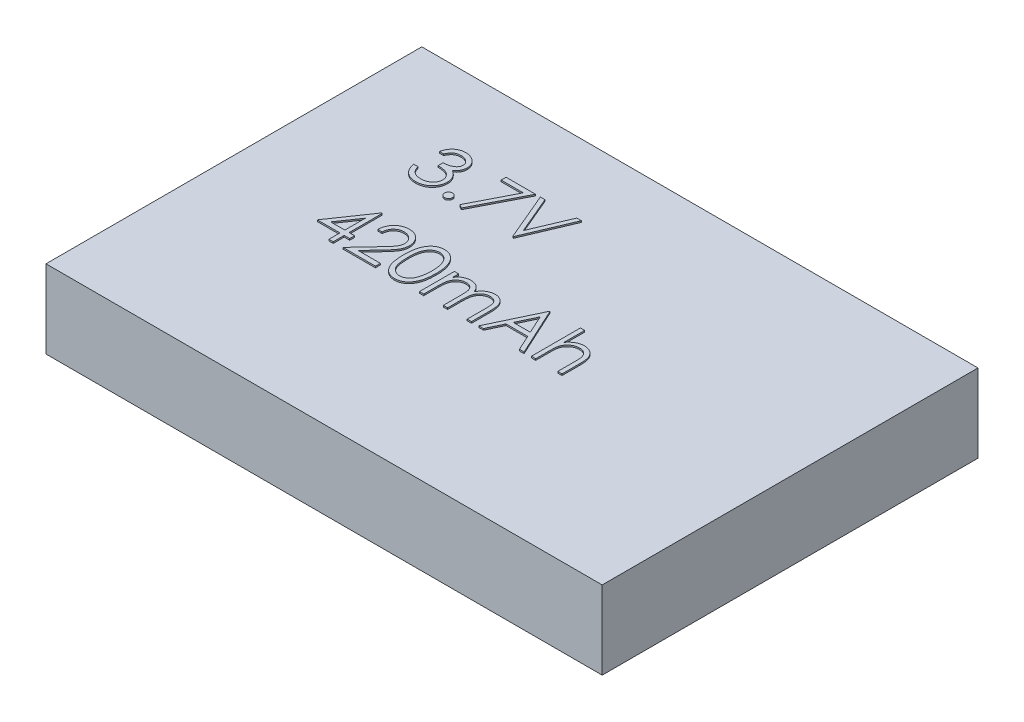
from build123d import *

# Parameters (mm, degrees)
SKETCH1_W           = 37
SKETCH1_H           = 25
BOSS_EXTRUDE1_DEPTH = 5.2
BOSS_EXTRUDE2_DEPTH = 0.1


with BuildPart() as part:
    # Sketch1 → Boss-Extrude1 (new body)
    with BuildSketch(Plane(origin=(0, 0, 0), x_dir=(1, 0, 0), z_dir=(0, 1, 0))):
        Rectangle(SKETCH1_W, SKETCH1_H)
    extrude(amount=BOSS_EXTRUDE1_DEPTH)

    # Sketch2 → Boss-Extrude2 (add)
    # profile 1 of 10: a face of its own
    with BuildSketch(Plane(origin=(0, 5.2, 0), x_dir=(1, 0, 0), z_dir=(0, 1, 0))):
        with BuildLine():
            Line((-11.502245155, 6.957480205), (-11.787181052, 6.957480205))
            add(Edge.make_bspline(
                [(-11.787181052, 6.957480205), (-11.779461674, 6.989441101), (-11.764370921, 7.051922039), (-11.732895265, 7.141191483), (-11.698605941, 7.22566782), (-11.657431539, 7.303769258), (-11.612520026, 7.377065406), (-11.561064415, 7.443893826), (-11.505438666, 7.505954159), (-11.443911748, 7.561029739), (-11.379387891, 7.610902393), (-11.310957914, 7.653424766), (-11.239998575, 7.690004534), (-11.166018233, 7.72014003), (-11.088796634, 7.742841755), (-11.009031905, 7.759312571), (-10.926515015, 7.770008796), (-10.870501129, 7.771052703), (-10.842058857, 7.771582769)],
                knots=[0, 0, 0, 0, 1.162005537, 2.271625781, 3.343758855, 4.383309926, 5.390229558, 6.379919256, 7.361854164, 8.333198761, 9.295911338, 10.242430842, 11.177959212, 12.116337295, 13.062827104, 14.020064771, 14.994644689, 16, 16, 16, 16], degree=3))
            add(Edge.make_bspline(
                [(-10.842058857, 7.771582769), (-10.800618084, 7.77033161), (-10.718640481, 7.767856584), (-10.598205431, 7.745255631), (-10.482066817, 7.709491404), (-10.371495856, 7.660075951), (-10.268790564, 7.59912746), (-10.177408451, 7.52658802), (-10.098588159, 7.443857225), (-10.032462545, 7.352478399), (-9.980687368, 7.254819473), (-9.942509015, 7.154307901), (-9.91926649, 7.051182113), (-9.91625427, 6.981552296), (-9.914745155, 6.946667905)],
                knots=[0, 0, 0, 0, 1.083050992, 2.142477498, 3.193116406, 4.255571735, 5.30263384, 6.308962982, 7.297363603, 8.282367274, 9.249857812, 10.179914175, 11.08814088, 12, 12, 12, 12], degree=3))
            add(Edge.make_bspline(
                [(-9.914745155, 6.946667905), (-9.915800698, 6.913097456), (-9.917866233, 6.847405296), (-9.935404666, 6.751500795), (-9.964919704, 6.661111629), (-10.005804417, 6.575857289), (-10.058728538, 6.496278327), (-10.12283877, 6.422195697), (-10.198587613, 6.353280818), (-10.25599065, 6.313802439), (-10.285543432, 6.293477801)],
                knots=[0, 0, 0, 0, 1.024540389, 2.004866551, 2.965041327, 3.920577974, 4.882998113, 5.874504559, 6.905732034, 8, 8, 8, 8], degree=3))
            add(Edge.make_bspline(
                [(-10.285543432, 6.293477801), (-10.251768912, 6.277169031), (-10.184851819, 6.244856641), (-10.093638124, 6.18148749), (-10.010836051, 6.10832066), (-9.964659106, 6.051222682), (-9.941457895, 6.022534292)],
                knots=[0, 0, 0, 0, 1.015518401, 2.012035669, 3.001164323, 4, 4, 4, 4], degree=3))
            add(Edge.make_bspline(
                [(-9.941457895, 6.022534292), (-9.926180392, 6.001617617), (-9.895875565, 5.960126793), (-9.858469045, 5.893418749), (-9.824533634, 5.825971327), (-9.798090221, 5.755976723), (-9.777612499, 5.684246203), (-9.762974812, 5.610656601), (-9.753881484, 5.535147823), (-9.752579234, 5.484064359), (-9.751924642, 5.458386655)],
                knots=[0, 0, 0, 0, 1.025084078, 2.033381695, 3.024893161, 4.013698104, 4.991890475, 5.976764909, 6.982997093, 8, 8, 8, 8], degree=3))
            add(Edge.make_bspline(
                [(-9.751924642, 5.458386655), (-9.753552522, 5.413927837), (-9.756800622, 5.325219424), (-9.785832889, 5.194160212), (-9.830839186, 5.066048506), (-9.894753692, 4.943516331), (-9.972647789, 4.828871271), (-10.065319076, 4.726294905), (-10.171714604, 4.638121885), (-10.290374014, 4.564452607), (-10.418931695, 4.505562777), (-10.55643241, 4.46468924), (-10.700894959, 4.438068226), (-10.799961579, 4.435213566), (-10.850327086, 4.433762256)],
                knots=[0, 0, 0, 0, 0.955779014, 1.907060117, 2.875433937, 3.871313158, 4.872415639, 5.851225146, 6.836215519, 7.83643374, 8.849228613, 9.86973379, 10.916971861, 12, 12, 12, 12], degree=3))
            add(Edge.make_bspline(
                [(-10.850327086, 4.433762256), (-10.884271737, 4.43454985), (-10.951063491, 4.436099571), (-11.049255807, 4.446693731), (-11.142983349, 4.466043093), (-11.232372841, 4.492081091), (-11.317503696, 4.5250936), (-11.398116134, 4.566204133), (-11.474706109, 4.614565281), (-11.546550871, 4.670747893), (-11.613641858, 4.733595966), (-11.674196115, 4.80422521), (-11.729223213, 4.881329998), (-11.777249749, 4.965805914), (-11.820463271, 5.056561254), (-11.856005996, 5.154758106), (-11.887289333, 5.259518612), (-11.901833975, 5.332523419), (-11.909296437, 5.369980205)],
                knots=[0, 0, 0, 0, 1.048658725, 2.063410685, 3.046034179, 4.001477787, 4.936774919, 5.862367409, 6.792675028, 7.730719943, 8.675894397, 9.627829632, 10.600096036, 11.597688215, 12.626045268, 13.701542398, 14.82072376, 16, 16, 16, 16], degree=3))
            Line((-11.909296437, 5.369980205), (-11.624360539, 5.369980205))
            add(Edge.make_bspline(
                [(-11.624360539, 5.369980205), (-11.616937125, 5.3455336), (-11.602497939, 5.29798283), (-11.57791954, 5.229547696), (-11.549917608, 5.166811462), (-11.519877973, 5.109313915), (-11.488328954, 5.056488807), (-11.453027557, 5.009732969), (-11.416588404, 4.96699275), (-11.389120705, 4.942912995), (-11.375677647, 4.931128042)],
                knots=[0, 0, 0, 0, 1.198163088, 2.33053128, 3.407730985, 4.417276592, 5.372219308, 6.28897303, 7.162600585, 8, 8, 8, 8], degree=3))
            add(Edge.make_bspline(
                [(-11.375677647, 4.931128042), (-11.357900752, 4.917422624), (-11.322401837, 4.890054096), (-11.264554941, 4.855127618), (-11.203717509, 4.824864402), (-11.13857134, 4.80174705), (-11.070522227, 4.782173029), (-10.99847026, 4.769363701), (-10.923051113, 4.760575145), (-10.871554642, 4.7597996), (-10.845238945, 4.759403282)],
                knots=[0, 0, 0, 0, 0.946170439, 1.889420265, 2.845303464, 3.807233317, 4.801018734, 5.828864929, 6.890507805, 8, 8, 8, 8], degree=3))
            add(Edge.make_bspline(
                [(-10.845238945, 4.759403282), (-10.815526839, 4.759961996), (-10.757427381, 4.761054513), (-10.672650473, 4.771101761), (-10.591998717, 4.785734351), (-10.516367562, 4.808333985), (-10.444766317, 4.836256615), (-10.378198677, 4.87131624), (-10.315790781, 4.91245038), (-10.258341963, 4.95920376), (-10.206684253, 5.010386116), (-10.161200551, 5.063919402), (-10.122533894, 5.119577904), (-10.091343077, 5.177669628), (-10.066713649, 5.237954014), (-10.049946746, 5.300600238), (-10.038288586, 5.365095615), (-10.037339159, 5.408936894), (-10.036860539, 5.431037897)],
                knots=[0, 0, 0, 0, 1.217147791, 2.380027433, 3.494444702, 4.572153297, 5.609568379, 6.639424714, 7.649109417, 8.668170816, 9.669597737, 10.625200337, 11.543417969, 12.441394052, 13.322311151, 14.205496177, 15.095365482, 16, 16, 16, 16], degree=3))
            add(Edge.make_bspline(
                [(-10.036860539, 5.431037897), (-10.038248742, 5.46062104), (-10.041018238, 5.519640125), (-10.06216245, 5.606469639), (-10.096941276, 5.690129449), (-10.145629912, 5.769192201), (-10.204898751, 5.842467483), (-10.274172631, 5.907846614), (-10.35402681, 5.961794482), (-10.427523405, 5.999067763), (-10.492624654, 6.024501396), (-10.548337182, 6.041442256), (-10.610709243, 6.055787501), (-10.678986574, 6.069133633), (-10.753683635, 6.080492285), (-10.834719103, 6.089964503), (-10.922109401, 6.097543719), (-10.982607816, 6.100928355), (-11.013783616, 6.102672513)],
                knots=[0, 0, 0, 0, 1.07054697, 2.135767047, 3.216561865, 4.33974944, 5.486079747, 6.621378074, 7.775625952, 8.963672916, 9.598146892, 10.304877434, 11.070270905, 11.915000392, 12.823868403, 13.805723172, 14.86925407, 16, 16, 16, 16], degree=3))
            Line((-11.013783616, 6.102672513), (-11.013783616, 6.428313538))
            add(Edge.make_bspline(
                [(-11.013783616, 6.428313538), (-10.974503273, 6.42898011), (-10.89756273, 6.430285761), (-10.785172897, 6.446077313), (-10.677700678, 6.467921883), (-10.577527848, 6.501382022), (-10.486225086, 6.540244291), (-10.407013733, 6.585467367), (-10.341003535, 6.635736461), (-10.288515277, 6.691827471), (-10.249028048, 6.751984692), (-10.220156596, 6.814683375), (-10.203102015, 6.880473058), (-10.200825388, 6.925371793), (-10.199681052, 6.947939941)],
                knots=[0, 0, 0, 0, 1.321986639, 2.589447074, 3.816329219, 5.01088745, 6.139805852, 7.153945165, 8.075214402, 8.924034688, 9.728124013, 10.488707548, 11.240355623, 12, 12, 12, 12], degree=3))
            add(Edge.make_bspline(
                [(-10.199681052, 6.947939941), (-10.200056982, 6.964520467), (-10.200804877, 6.997506637), (-10.210236693, 7.045698663), (-10.22440993, 7.092417378), (-10.243895113, 7.137464106), (-10.269975651, 7.180526426), (-10.301186796, 7.221971469), (-10.338350715, 7.261562611), (-10.380936942, 7.298465473), (-10.426667651, 7.333634709), (-10.47678709, 7.36349208), (-10.529784076, 7.389023672), (-10.585717285, 7.410078006), (-10.64476823, 7.425916075), (-10.706659464, 7.437287874), (-10.771509006, 7.444397746), (-10.815751934, 7.445421381), (-10.838242751, 7.445941743)],
                knots=[0, 0, 0, 0, 0.884392785, 1.759457502, 2.611959086, 3.489218968, 4.37281399, 5.2945488, 6.255912374, 7.266815255, 8.301784654, 9.332968512, 10.37626691, 11.440494194, 12.520033166, 13.637162961, 14.798855837, 16, 16, 16, 16], degree=3))
            add(Edge.make_bspline(
                [(-10.838242751, 7.445941743), (-10.874393907, 7.444679579), (-10.945005523, 7.442214279), (-11.046800483, 7.420621546), (-11.141433022, 7.386169999), (-11.213767384, 7.345046474), (-11.26718229, 7.304451437), (-11.305352084, 7.26899813), (-11.34283569, 7.229598354), (-11.377167125, 7.183825399), (-11.41188709, 7.134779097), (-11.443496085, 7.079966186), (-11.474211663, 7.020816485), (-11.49271969, 6.979001159), (-11.502245155, 6.957480205)],
                knots=[0, 0, 0, 0, 1.472543308, 2.876219568, 4.221790263, 5.565193594, 6.249813518, 6.953379497, 7.687249741, 8.463570142, 9.283606569, 10.136032583, 11.040678096, 12, 12, 12, 12], degree=3))
        make_face()
    # profile 2 of 10: a face of its own
    with BuildSketch(Plane(origin=(0, 5.2, 0), x_dir=(1, 0, 0), z_dir=(0, 1, 0))):
        with BuildLine():
            add(Edge.make_bspline(
                [(-8.958174642, 5.003634051), (-8.940494235, 5.002583429), (-8.905833865, 5.000523806), (-8.855724084, 4.986393537), (-8.810371786, 4.961303181), (-8.769974678, 4.927863375), (-8.73667666, 4.887318023), (-8.71069214, 4.842327449), (-8.696684961, 4.791798147), (-8.694640341, 4.756936942), (-8.693591309, 4.739050718)],
                knots=[0, 0, 0, 0, 1.020151414, 1.999887582, 2.974338812, 3.990962822, 5.007586832, 5.987933904, 6.967670073, 8, 8, 8, 8], degree=3))
            add(Edge.make_bspline(
                [(-8.693591309, 4.739050718), (-8.694675889, 4.721594269), (-8.696814667, 4.687170407), (-8.710660032, 4.637022223), (-8.736874692, 4.592003531), (-8.769745007, 4.55090802), (-8.810381772, 4.517397374), (-8.855831304, 4.492520482), (-8.905716231, 4.477378472), (-8.94047461, 4.475449617), (-8.958174642, 4.474467384)],
                knots=[0, 0, 0, 0, 1.009421747, 1.99056486, 2.972319754, 3.999869655, 5.017953583, 5.993804169, 6.978383603, 8, 8, 8, 8], degree=3))
            add(Edge.make_bspline(
                [(-8.958174642, 4.474467384), (-8.975887428, 4.475414076), (-9.010467426, 4.477262266), (-9.060166149, 4.492831384), (-9.105892471, 4.517164094), (-9.146521323, 4.550970505), (-9.179666937, 4.591792063), (-9.204727106, 4.637332264), (-9.219776741, 4.687026854), (-9.221756011, 4.721565994), (-9.222757975, 4.739050718)],
                knots=[0, 0, 0, 0, 1.022052826, 1.995314843, 2.982371812, 4.00089066, 5.028879526, 6.005146991, 6.990147033, 8, 8, 8, 8], degree=3))
            add(Edge.make_bspline(
                [(-9.222757975, 4.739050718), (-9.2217945, 4.756966227), (-9.219913431, 4.791944059), (-9.204695511, 4.842017535), (-9.179861376, 4.887527476), (-9.146292196, 4.927801516), (-9.105902299, 4.961535712), (-9.060276456, 4.986087346), (-9.01034773, 5.000638292), (-8.975867286, 5.002618146), (-8.958174642, 5.003634051)],
                knots=[0, 0, 0, 0, 1.032775665, 2.016367738, 2.991239715, 4.008302682, 5.025365648, 6.011011707, 6.979408107, 8, 8, 8, 8], degree=3))
        make_face()
    # profile 3 of 10: a face of its own
    with BuildSketch(Plane(origin=(0, 5.2, 0), x_dir=(1, 0, 0), z_dir=(0, 1, 0))):
        Polygon((-8.083014386, 7.690172513), (-6.129168232, 7.690172513), (-7.798078488, 4.433762256), (-8.04421731, 4.569234011), (-6.611269594, 7.364531487), (-8.083014386, 7.364531487), align=None)
    # profile 4 of 10: a face of its own
    with BuildSketch(Plane(origin=(0, 5.2, 0), x_dir=(1, 0, 0), z_dir=(0, 1, 0))):
        Polygon((-5.803527206, 7.690172513), (-5.498238745, 7.690172513), (-4.439905411, 5.188079163), (-3.381572078, 7.690172513), (-3.076283616, 7.690172513), (-4.419552847, 4.515172513), (-4.460257975, 4.515172513), align=None)
    # profile 5 of 10: a face of its own
    with BuildSketch(Plane(origin=(0, 5.2, 0), x_dir=(1, 0, 0), z_dir=(0, 1, 0))):
        Polygon((-10.1761484, 1.479916102), (-10.118270796, 1.479916102), (-10.118270796, -0.718160821), (-9.751924642, -0.718160821), (-9.751924642, -1.043801846), (-10.118270796, -1.043801846), (-10.118270796, -1.776494154), (-10.403206693, -1.776494154), (-10.403206693, -1.043801846), (-11.909296437, -1.043801846), align=None)
        Polygon((-10.403206693, -0.718160821), (-10.403206693, 0.660725397), (-11.349600924, -0.718160821), align=None, mode=Mode.SUBTRACT)
    # profile 6 of 10: a face of its own
    with BuildSketch(Plane(origin=(0, 5.2, 0), x_dir=(1, 0, 0), z_dir=(0, 1, 0))):
        with BuildLine():
            Line((-9.059937463, 0.421582769), (-9.34487336, 0.421582769))
            add(Edge.make_bspline(
                [(-9.34487336, 0.421582769), (-9.3430163, 0.459384217), (-9.339369083, 0.533625256), (-9.322289135, 0.641869085), (-9.29784991, 0.745333081), (-9.26329552, 0.843186503), (-9.220381968, 0.936294564), (-9.168919729, 1.024287435), (-9.107965307, 1.106829442), (-9.038834913, 1.183155393), (-8.963751933, 1.253175546), (-8.882738688, 1.313641374), (-8.797607842, 1.364729547), (-8.708617673, 1.407438959), (-8.614764162, 1.439497248), (-8.516898998, 1.463284021), (-8.41459221, 1.47759542), (-8.344887333, 1.47913374), (-8.309436661, 1.479916102)],
                knots=[0, 0, 0, 0, 1.10065271, 2.161652631, 3.183658789, 4.190468796, 5.17591951, 6.163126047, 7.15150782, 8.156236427, 9.156009102, 10.134482811, 11.092018607, 12.041330605, 13.001268258, 13.972401359, 14.968799086, 16, 16, 16, 16], degree=3))
            add(Edge.make_bspline(
                [(-8.309436661, 1.479916102), (-8.274622265, 1.479101074), (-8.206213221, 1.477499573), (-8.106371251, 1.463746353), (-8.011323277, 1.442205709), (-7.921255089, 1.411983867), (-7.836885302, 1.371357994), (-7.757580111, 1.322555941), (-7.682395376, 1.266113665), (-7.614716365, 1.199661992), (-7.55256975, 1.128721257), (-7.498955561, 1.052985802), (-7.453042192, 0.974763521), (-7.414771939, 0.893457938), (-7.386599585, 0.808303505), (-7.365210782, 0.720539971), (-7.353120914, 0.629258893), (-7.351265422, 0.567476517), (-7.350322078, 0.536065942)],
                knots=[0, 0, 0, 0, 1.111607364, 2.184268762, 3.212621178, 4.221274766, 5.211760367, 6.196651075, 7.1921475, 8.207485113, 9.220403448, 10.201281604, 11.166441695, 12.114753415, 13.065576456, 14.026450734, 14.996634279, 16, 16, 16, 16], degree=3))
            add(Edge.make_bspline(
                [(-7.350322078, 0.536065942), (-7.351858109, 0.491844692), (-7.354903217, 0.404178213), (-7.380951258, 0.275350444), (-7.42163345, 0.150533557), (-7.470616767, 0.050079004), (-7.520031056, -0.030868522), (-7.564560437, -0.097515133), (-7.61668923, -0.169275094), (-7.677176153, -0.245908107), (-7.744769973, -0.328014428), (-7.820082936, -0.415544456), (-7.903652094, -0.507593848), (-7.962306591, -0.570463929), (-7.992699882, -0.60304163)],
                knots=[0, 0, 0, 0, 1.184426356, 2.348067706, 3.509069118, 4.696110526, 5.333549288, 6.050745305, 6.844228056, 7.710549037, 8.667450064, 9.695053472, 10.805634456, 12, 12, 12, 12], degree=3))
            Line((-7.992699882, -0.60304163), (-8.7870859, -1.450853128))
            Line((-8.7870859, -1.450853128), (-7.30961695, -1.450853128))
            Line((-7.30961695, -1.450853128), (-7.30961695, -1.776494154))
            Line((-7.30961695, -1.776494154), (-9.466988745, -1.776494154))
            Line((-9.466988745, -1.776494154), (-8.235658616, -0.462481734))
            add(Edge.make_bspline(
                [(-8.235658616, -0.462481734), (-8.205679462, -0.431186842), (-8.148095642, -0.371075758), (-8.066650018, -0.283316073), (-7.993498936, -0.201900418), (-7.928168873, -0.126982621), (-7.87207705, -0.057466841), (-7.822300097, 0.004395497), (-7.782417025, 0.061322748), (-7.739132344, 0.127308877), (-7.697209661, 0.207874336), (-7.661184881, 0.306329897), (-7.639218554, 0.407682476), (-7.636583454, 0.47617361), (-7.635257975, 0.510625237)],
                knots=[0, 0, 0, 0, 1.329631726, 2.553950428, 3.673215718, 4.687767853, 5.603093632, 6.413772471, 7.123043292, 7.734684054, 8.834405432, 9.900288307, 10.943827018, 12, 12, 12, 12], degree=3))
            add(Edge.make_bspline(
                [(-7.635257975, 0.510625237), (-7.635834684, 0.532289077), (-7.636971267, 0.574984346), (-7.647002179, 0.637582427), (-7.662160995, 0.697966222), (-7.683882765, 0.75632147), (-7.712554593, 0.812061454), (-7.747455445, 0.865254025), (-7.787723574, 0.916679015), (-7.834306511, 0.96489665), (-7.885479818, 1.009057458), (-7.939540316, 1.048177164), (-7.996735768, 1.080869786), (-8.056825022, 1.107669958), (-8.119640555, 1.12869334), (-8.185303859, 1.143260765), (-8.253633502, 1.152407019), (-8.300291031, 1.153644517), (-8.324065067, 1.154275077)],
                knots=[0, 0, 0, 0, 0.991446411, 1.95395049, 2.89581595, 3.838931463, 4.798493298, 5.75982156, 6.748411868, 7.785213223, 8.824556874, 9.840280684, 10.836137867, 11.835679398, 12.848801643, 13.863922112, 14.911575587, 16, 16, 16, 16], degree=3))
            add(Edge.make_bspline(
                [(-8.324065067, 1.154275077), (-8.348894322, 1.15362644), (-8.39765488, 1.152352626), (-8.469245717, 1.143442066), (-8.537540672, 1.128069768), (-8.602711542, 1.107045213), (-8.664868594, 1.080322101), (-8.723709549, 1.047037447), (-8.779102312, 1.007319564), (-8.831151016, 0.962288488), (-8.879106197, 0.912152878), (-8.921240148, 0.85626384), (-8.958055647, 0.795641828), (-8.99017688, 0.730450414), (-9.016262399, 0.660098057), (-9.036195186, 0.584834496), (-9.051967539, 0.504986528), (-9.057236697, 0.449845773), (-9.059937463, 0.421582769)],
                knots=[0, 0, 0, 0, 1.031018746, 2.02475058, 2.990194455, 3.934040569, 4.864654155, 5.795059489, 6.735614925, 7.690564532, 8.649604399, 9.611025574, 10.590972636, 11.591080095, 12.624614302, 13.701020113, 14.821632451, 16, 16, 16, 16], degree=3))
        make_face()
    # profile 7 of 10: a face of its own
    with BuildSketch(Plane(origin=(0, 5.2, 0), x_dir=(1, 0, 0), z_dir=(0, 1, 0))):
        with BuildLine():
            add(Edge.make_bspline(
                [(-7.024681052, -0.190266189), (-7.024383493, -0.139377845), (-7.02380548, -0.040526502), (-7.017375269, 0.103513852), (-7.006693352, 0.238642114), (-6.992054449, 0.364864753), (-6.974239996, 0.482214353), (-6.950458804, 0.590377312), (-6.923414333, 0.689854241), (-6.892070329, 0.780969527), (-6.856702834, 0.864950729), (-6.818208898, 0.943350733), (-6.775060834, 1.016050915), (-6.729724635, 1.084211625), (-6.680365113, 1.146717119), (-6.628386924, 1.204450106), (-6.571761365, 1.256076287), (-6.51241335, 1.30310829), (-6.449805558, 1.344337453), (-6.385722568, 1.380652866), (-6.319723293, 1.411677031), (-6.251627541, 1.436070498), (-6.182047364, 1.456218909), (-6.110739525, 1.469997455), (-6.037586288, 1.478666936), (-5.9882092, 1.479495763), (-5.963167631, 1.479916102)],
                knots=[0, 0, 0, 0, 1.646270934, 3.197905019, 4.663502075, 6.030701355, 7.308322542, 8.50163776, 9.611534131, 10.641858119, 11.616356847, 12.558055219, 13.465016945, 14.349605745, 15.204443733, 16.039544428, 16.859896111, 17.680448484, 18.487036065, 19.28249412, 20.06191084, 20.843045899, 21.620316918, 22.403196591, 23.190181807, 24, 24, 24, 24], degree=3))
            add(Edge.make_bspline(
                [(-5.963167631, 1.479916102), (-5.937916875, 1.479473584), (-5.887701067, 1.478593555), (-5.813460155, 1.470135407), (-5.740934373, 1.456100889), (-5.670432918, 1.436215433), (-5.601376681, 1.411545069), (-5.534305797, 1.380623184), (-5.468803658, 1.344628783), (-5.405911183, 1.302334266), (-5.344937925, 1.255178915), (-5.287381558, 1.20187278), (-5.233236845, 1.142954106), (-5.181824246, 1.079053273), (-5.134602383, 1.00894466), (-5.089632198, 0.933847646), (-5.049380423, 0.852448933), (-5.010613967, 0.766106651), (-4.977152201, 0.672431761), (-4.946974964, 0.5719523), (-4.9225919, 0.46348143), (-4.902281631, 0.347588265), (-4.886547333, 0.223847191), (-4.875087722, 0.092523462), (-4.86903428, -0.046469321), (-4.867894273, -0.141499656), (-4.867309257, -0.190266189)],
                knots=[0, 0, 0, 0, 0.810914788, 1.612654377, 2.396697861, 3.181598691, 3.963628158, 4.749916497, 5.551656086, 6.361998678, 7.18212741, 8.025565596, 8.878627764, 9.750805457, 10.657531673, 11.591944965, 12.560506719, 13.57287815, 14.630710178, 15.753379473, 16.941251878, 18.199788006, 19.531962791, 20.947069417, 22.433333509, 24, 24, 24, 24], degree=3))
            add(Edge.make_bspline(
                [(-4.867309257, -0.190266189), (-4.867900338, -0.23882002), (-4.869052033, -0.333425179), (-4.87501986, -0.471792564), (-4.88677519, -0.60241936), (-4.901479965, -0.725618851), (-4.921846196, -0.840878263), (-4.946888025, -0.948596441), (-4.974692247, -1.049238563), (-5.00901381, -1.141980142), (-5.04657924, -1.228114919), (-5.087450739, -1.30854869), (-5.131238367, -1.383992398), (-5.178943872, -1.453842168), (-5.229792325, -1.518592807), (-5.284872034, -1.577101365), (-5.34263035, -1.630777617), (-5.403783041, -1.678540165), (-5.467656377, -1.720345667), (-5.53293354, -1.757732517), (-5.600772752, -1.787879318), (-5.669636645, -1.813764677), (-5.740510234, -1.833540801), (-5.813305174, -1.847214942), (-5.887651188, -1.856805118), (-5.937908322, -1.857536711), (-5.963167631, -1.85790441)],
                knots=[0, 0, 0, 0, 1.561518951, 3.042555995, 4.452378317, 5.7783523, 7.031515105, 8.214008947, 9.334062868, 10.386615937, 11.391082383, 12.354592575, 13.286541444, 14.194233754, 15.072674879, 15.931287219, 16.775624067, 17.606195743, 18.42308326, 19.229000347, 20.022332153, 20.807536673, 21.593273796, 22.3848459, 23.188221202, 24, 24, 24, 24], degree=3))
            add(Edge.make_bspline(
                [(-5.963167631, -1.85790441), (-5.988208506, -1.857481359), (-6.037584223, -1.856647185), (-6.110747495, -1.848016872), (-6.181760854, -1.834141665), (-6.250974724, -1.814713746), (-6.318744205, -1.790933144), (-6.384145837, -1.759950874), (-6.447906807, -1.724269255), (-6.509857004, -1.683633408), (-6.568832322, -1.63707731), (-6.625164628, -1.585583991), (-6.677438753, -1.527868468), (-6.726092539, -1.464842066), (-6.772333319, -1.397084625), (-6.814868679, -1.323671029), (-6.85421224, -1.244892375), (-6.890174549, -1.160239699), (-6.922059408, -1.068477729), (-6.950224115, -0.968556688), (-6.972461958, -0.859594647), (-6.991496496, -0.74246675), (-7.006849329, -0.616669684), (-7.017330753, -0.482135157), (-7.023808946, -0.338947003), (-7.024385045, -0.240730851), (-7.024681052, -0.190266189)],
                knots=[0, 0, 0, 0, 0.810891512, 1.598919785, 2.382837074, 3.152667961, 3.926044502, 4.706494248, 5.493654104, 6.291793342, 7.103789334, 7.925228297, 8.761435821, 9.622817696, 10.50288917, 11.416980706, 12.369136599, 13.353924996, 14.394355917, 15.514179734, 16.714354668, 17.994756427, 19.357759367, 20.818452758, 22.365282078, 24, 24, 24, 24], degree=3))
        make_face()
        with BuildLine():
            add(Edge.make_bspline(
                [(-6.739745155, -0.188994154), (-6.739636799, -0.231401902), (-6.739426502, -0.313707014), (-6.733932663, -0.433307687), (-6.726448524, -0.544859342), (-6.716795348, -0.648503622), (-6.702459816, -0.743889704), (-6.68639723, -0.831673631), (-6.666850034, -0.911390839), (-6.643722411, -0.983588353), (-6.617379801, -1.049491437), (-6.588618054, -1.110815396), (-6.557720112, -1.168284653), (-6.523140597, -1.221382998), (-6.485480504, -1.270283589), (-6.445590476, -1.315851944), (-6.401981775, -1.356489206), (-6.34165338, -1.405227139), (-6.262009435, -1.455590924), (-6.161660879, -1.499447734), (-6.058547356, -1.527008963), (-5.98856015, -1.530513941), (-5.953627366, -1.532263385)],
                knots=[0, 0, 0, 0, 1.459021318, 2.831673884, 4.118529203, 5.306027144, 6.411944654, 7.436330062, 8.375795394, 9.233974572, 10.042671642, 10.816086306, 11.563610507, 12.285937304, 12.993564865, 13.685989202, 14.367179055, 15.041617293, 16.353048772, 17.594441528, 18.799311195, 20, 20, 20, 20], degree=3))
            add(Edge.make_bspline(
                [(-5.953627366, -1.532263385), (-5.918468621, -1.530813969), (-5.848223721, -1.527918131), (-5.745595207, -1.499979276), (-5.645963462, -1.457824765), (-5.567883916, -1.407979528), (-5.508481894, -1.360510258), (-5.465921482, -1.320038399), (-5.426858052, -1.27472129), (-5.389808456, -1.225826929), (-5.355827723, -1.172421176), (-5.324927591, -1.114760839), (-5.296730554, -1.052685799), (-5.28066592, -1.009351822), (-5.272452487, -0.987196277)],
                knots=[0, 0, 0, 0, 1.353760809, 2.704726607, 4.075137775, 5.516104923, 6.260822281, 7.007110065, 7.778089737, 8.566572457, 9.372053459, 10.217411131, 11.088608312, 12, 12, 12, 12], degree=3))
            add(Edge.make_bspline(
                [(-5.272452487, -0.987196277), (-5.262880526, -0.958866442), (-5.24344534, -0.901344728), (-5.218397517, -0.812114843), (-5.198671333, -0.718495193), (-5.180924566, -0.621045266), (-5.168811436, -0.519046394), (-5.159061634, -0.412814174), (-5.153318797, -0.30226851), (-5.152606915, -0.227161625), (-5.152245155, -0.188994154)],
                knots=[0, 0, 0, 0, 0.884706709, 1.796334032, 2.740027952, 3.714592787, 4.726048262, 5.777819803, 6.87074269, 8, 8, 8, 8], degree=3))
            add(Edge.make_bspline(
                [(-5.152245155, -0.188994154), (-5.152744255, -0.150832856), (-5.153720602, -0.076181199), (-5.157452576, 0.033146007), (-5.167089676, 0.136984619), (-5.177793163, 0.235781976), (-5.193574927, 0.32899118), (-5.210590938, 0.417392528), (-5.233452038, 0.499890843), (-5.257872119, 0.577777749), (-5.285821549, 0.650168343), (-5.316587965, 0.717400135), (-5.349446275, 0.779797707), (-5.385135308, 0.837189861), (-5.423231392, 0.889833668), (-5.464740025, 0.936673621), (-5.508014707, 0.979161443), (-5.568627439, 1.02765963), (-5.647979117, 1.077109525), (-5.746717668, 1.122617036), (-5.849470324, 1.148750273), (-5.918933386, 1.152434803), (-5.953627366, 1.154275077)],
                knots=[0, 0, 0, 0, 1.31362396, 2.569729283, 3.763502607, 4.902122613, 5.988968491, 7.01645872, 7.998833611, 8.933434873, 9.825090667, 10.667526885, 11.477055099, 12.250526234, 12.991942729, 13.710640831, 14.402115721, 15.076753259, 16.378508321, 17.609869233, 18.806226677, 20, 20, 20, 20], degree=3))
            add(Edge.make_bspline(
                [(-5.953627366, 1.154275077), (-5.988743403, 1.152432264), (-6.059039451, 1.148743283), (-6.162860095, 1.122714403), (-6.262377614, 1.077345498), (-6.341519456, 1.027495846), (-6.402174462, 0.98001752), (-6.444885191, 0.938845523), (-6.484932076, 0.893809278), (-6.521823489, 0.844458969), (-6.556375911, 0.791422529), (-6.588108686, 0.734282721), (-6.616699407, 0.672749983), (-6.643083236, 0.606876503), (-6.666281408, 0.534685217), (-6.685416646, 0.455066202), (-6.703094187, 0.367561486), (-6.715608467, 0.271658789), (-6.726733445, 0.16798855), (-6.733882954, 0.056158411), (-6.73944488, -0.063642848), (-6.739643059, -0.146373513), (-6.739745155, -0.188994154)],
                knots=[0, 0, 0, 0, 1.207732386, 2.417664972, 3.655092373, 4.956220595, 5.625982001, 6.301752483, 6.994047911, 7.697131622, 8.419323945, 9.170223765, 9.943494443, 10.752040957, 11.610060368, 12.549350801, 13.567764191, 14.679664412, 15.874934091, 17.154273443, 18.533957287, 20, 20, 20, 20], degree=3))
        make_face(mode=Mode.SUBTRACT)
    # profile 8 of 10: a face of its own
    with BuildSketch(Plane(origin=(0, 5.2, 0), x_dir=(1, 0, 0), z_dir=(0, 1, 0))):
        with BuildLine():
            Line((-4.378847719, 0.543698154), (-4.093911822, 0.543698154))
            Line((-4.093911822, 0.543698154), (-4.093911822, 0.140462977))
            add(Edge.make_bspline(
                [(-4.093911822, 0.140462977), (-4.068254238, 0.175739588), (-4.019091849, 0.243332955), (-3.938478007, 0.33240557), (-3.857945391, 0.40799611), (-3.79994868, 0.447677143), (-3.772086902, 0.466740021)],
                knots=[0, 0, 0, 0, 1.134379233, 2.173579362, 3.122582517, 4, 4, 4, 4], degree=3))
            add(Edge.make_bspline(
                [(-3.772086902, 0.466740021), (-3.734109672, 0.484887745), (-3.65881872, 0.520866131), (-3.539602709, 0.557363717), (-3.417614973, 0.579792916), (-3.335238951, 0.582860305), (-3.293801645, 0.584403282)],
                knots=[0, 0, 0, 0, 1.014936303, 2.012140481, 3.000054389, 4, 4, 4, 4], degree=3))
            add(Edge.make_bspline(
                [(-3.293801645, 0.584403282), (-3.265777284, 0.583455054), (-3.21031858, 0.581578562), (-3.12814587, 0.569368387), (-3.048445558, 0.548262644), (-2.971688545, 0.518864572), (-2.899370501, 0.48326222), (-2.833068157, 0.441488556), (-2.773537625, 0.394591924), (-2.720808993, 0.340454606), (-2.67339352, 0.277556406), (-2.629779138, 0.20420098), (-2.589479124, 0.118741173), (-2.567144079, 0.056722954), (-2.555385179, 0.024071751)],
                knots=[0, 0, 0, 0, 1.009824226, 1.998387844, 2.986035974, 3.974953746, 4.955485308, 5.885931332, 6.793869504, 7.679848016, 8.601185859, 9.625726857, 10.749998409, 12, 12, 12, 12], degree=3))
            add(Edge.make_bspline(
                [(-2.555385179, 0.024071751), (-2.542947115, 0.046500332), (-2.518470752, 0.090636628), (-2.477372067, 0.153100909), (-2.434311995, 0.21152707), (-2.388923562, 0.265961469), (-2.341366972, 0.316135296), (-2.291418416, 0.362214436), (-2.239362222, 0.404396772), (-2.166979261, 0.453675638), (-2.072806396, 0.506018853), (-1.954072178, 0.551401799), (-1.830564522, 0.579447144), (-1.746728467, 0.58274032), (-1.704393592, 0.584403282)],
                knots=[0, 0, 0, 0, 0.86119277, 1.694706429, 2.50939023, 3.298075842, 4.073795165, 4.829715201, 5.57930267, 6.321991688, 7.768977793, 9.186738141, 10.579381044, 12, 12, 12, 12], degree=3))
            add(Edge.make_bspline(
                [(-1.704393592, 0.584403282), (-1.66549398, 0.582936232), (-1.589363661, 0.580065072), (-1.478531427, 0.557519421), (-1.375169932, 0.518804698), (-1.279487156, 0.465978471), (-1.193163611, 0.399594497), (-1.118128102, 0.320610623), (-1.054836415, 0.229585529), (-1.013490078, 0.143958511), (-0.985445516, 0.068361459), (-0.968154254, 0.003948609), (-0.952878245, -0.066946014), (-0.940195258, -0.14440718), (-0.930925571, -0.228708517), (-0.924057851, -0.319712069), (-0.919409584, -0.417488563), (-0.919081133, -0.484948695), (-0.918911822, -0.519723321)],
                knots=[0, 0, 0, 0, 1.209669288, 2.367440248, 3.500751976, 4.631527125, 5.755587489, 6.87532382, 8.007944318, 9.190864318, 9.82315674, 10.514484317, 11.263564316, 12.079023757, 12.955305781, 13.901327259, 14.918167583, 16, 16, 16, 16], degree=3))
            Line((-0.918911822, -0.519723321), (-0.918911822, -1.776494154))
            Line((-0.918911822, -1.776494154), (-1.203847719, -1.776494154))
            Line((-1.203847719, -1.776494154), (-1.203847719, -0.518451285))
            add(Edge.make_bspline(
                [(-1.203847719, -0.518451285), (-1.20391837, -0.48876905), (-1.20405415, -0.431724309), (-1.206497659, -0.349852443), (-1.211101694, -0.27522329), (-1.216485259, -0.20793861), (-1.223963572, -0.147841495), (-1.233620953, -0.095052658), (-1.24385142, -0.049156843), (-1.26084764, 0.001721214), (-1.288014656, 0.057846334), (-1.329396227, 0.118374149), (-1.381529824, 0.171061732), (-1.441727966, 0.216798348), (-1.510261198, 0.253985437), (-1.585794196, 0.28054296), (-1.667858015, 0.296982999), (-1.72466583, 0.298621313), (-1.754002967, 0.299467384)],
                knots=[0, 0, 0, 0, 1.253487763, 2.409012846, 3.458416907, 4.410876679, 5.259312806, 6.014470957, 6.676830364, 7.243083969, 8.276244668, 9.299465089, 10.325150304, 11.392391894, 12.482080715, 13.603491619, 14.762376348, 16, 16, 16, 16], degree=3))
            add(Edge.make_bspline(
                [(-1.754002967, 0.299467384), (-1.789989283, 0.298182727), (-1.861111924, 0.295643757), (-1.964930329, 0.269723172), (-2.064689752, 0.23064323), (-2.157413479, 0.174008073), (-2.242710118, 0.1061462), (-2.316097592, 0.025456209), (-2.376723932, -0.06582951), (-2.417775753, -0.150326876), (-2.443710333, -0.226227014), (-2.460834393, -0.292536773), (-2.474154326, -0.367903624), (-2.486646163, -0.451821133), (-2.494799317, -0.54486694), (-2.502209197, -0.646610632), (-2.505675266, -0.757358224), (-2.506160096, -0.83412672), (-2.506411822, -0.87398514)],
                knots=[0, 0, 0, 0, 1.090531906, 2.155305635, 3.229839962, 4.33261226, 5.44038871, 6.529323825, 7.629011124, 8.757537029, 9.370236727, 10.061839251, 10.834451254, 11.692844982, 12.636905849, 13.66920014, 14.789842145, 16, 16, 16, 16], degree=3))
            Line((-2.506411822, -0.87398514), (-2.506411822, -1.776494154))
            Line((-2.506411822, -1.776494154), (-2.791347719, -1.776494154))
            Line((-2.791347719, -1.776494154), (-2.791347719, -0.596681454))
            add(Edge.make_bspline(
                [(-2.791347719, -0.596681454), (-2.791419774, -0.563395372), (-2.791558401, -0.499356295), (-2.793986203, -0.40752289), (-2.798600496, -0.323992196), (-2.803934993, -0.248861297), (-2.811609584, -0.182266734), (-2.820327011, -0.123851489), (-2.830621822, -0.073762008), (-2.847666932, -0.018822366), (-2.873715056, 0.041703043), (-2.915614408, 0.106238112), (-2.967872713, 0.162724172), (-3.029169151, 0.210946751), (-3.098117162, 0.250807952), (-3.174302105, 0.279527869), (-3.25703799, 0.296241332), (-3.314077052, 0.298371754), (-3.34341102, 0.299467384)],
                knots=[0, 0, 0, 0, 1.320475261, 2.540461679, 3.643808994, 4.639130445, 5.527981419, 6.302341397, 6.981980563, 7.553956391, 8.582137848, 9.585246428, 10.591171744, 11.620968678, 12.668337649, 13.738356861, 14.836885341, 16, 16, 16, 16], degree=3))
            add(Edge.make_bspline(
                [(-3.34341102, 0.299467384), (-3.377897155, 0.298079039), (-3.446626797, 0.295312115), (-3.547593583, 0.270407166), (-3.645098454, 0.231396327), (-3.73758593, 0.177276348), (-3.822561765, 0.110239327), (-3.896954979, 0.0313951), (-3.959495698, -0.058275095), (-4.000980988, -0.141881478), (-4.027740318, -0.215880091), (-4.045516086, -0.278791308), (-4.060792032, -0.348641533), (-4.072144037, -0.42564627), (-4.0831027, -0.509303977), (-4.088391623, -0.600031406), (-4.09353654, -0.697750729), (-4.093783659, -0.765217252), (-4.093911822, -0.800207095)],
                knots=[0, 0, 0, 0, 1.098833095, 2.189935336, 3.297829714, 4.440610912, 5.596351641, 6.740013378, 7.886572111, 9.072425424, 9.705826452, 10.395263256, 11.156850408, 11.985370555, 12.878090359, 13.847760091, 14.883794034, 16, 16, 16, 16], degree=3))
            Line((-4.093911822, -0.800207095), (-4.093911822, -1.776494154))
            Line((-4.093911822, -1.776494154), (-4.378847719, -1.776494154))
            Line((-4.378847719, -1.776494154), (-4.378847719, 0.543698154))
        make_face()
    # profile 9 of 10: a face of its own
    with BuildSketch(Plane(origin=(0, 5.2, 0), x_dir=(1, 0, 0), z_dir=(0, 1, 0))):
        Polygon((1.116344589, 1.398505846), (2.581729204, -1.776494154), (2.271988619, -1.776494154), (1.80260761, -0.758865949), (0.363299717, -0.758865949), (-0.119437663, -1.776494154), (-0.430450283, -1.776494154), (1.075639461, 1.398505846), align=None)
        Polygon((1.092811937, 0.779660694), (0.517852001, -0.433224923), (1.652507449, -0.433224923), align=None, mode=Mode.SUBTRACT)
    # profile 10 of 10: a face of its own
    with BuildSketch(Plane(origin=(0, 5.2, 0), x_dir=(1, 0, 0), z_dir=(0, 1, 0))):
        with BuildLine():
            Line((3.070190743, 1.479916102), (3.35512664, 1.479916102))
            Line((3.35512664, 1.479916102), (3.35512664, 0.105482008))
            add(Edge.make_bspline(
                [(3.35512664, 0.105482008), (3.385713049, 0.14371262), (3.445266356, 0.218149581), (3.545502119, 0.315269376), (3.64843641, 0.399450982), (3.757624487, 0.46646204), (3.871063174, 0.519399761), (3.989230908, 0.556944269), (4.112149646, 0.58003205), (4.195629604, 0.582933472), (4.237919108, 0.584403282)],
                knots=[0, 0, 0, 0, 1.125788106, 2.19196713, 3.20547328, 4.180437432, 5.132270164, 6.079753143, 7.027236121, 8, 8, 8, 8], degree=3))
            add(Edge.make_bspline(
                [(4.237919108, 0.584403282), (4.280854536, 0.582819927), (4.364889525, 0.57972092), (4.48724628, 0.555215925), (4.601510788, 0.513344535), (4.707343374, 0.456043019), (4.802434349, 0.384675526), (4.88666235, 0.302278359), (4.955460788, 0.206779876), (5.002268559, 0.11855456), (5.032724436, 0.040051547), (5.052002878, -0.027291575), (5.068348865, -0.102332167), (5.082590769, -0.185031603), (5.092082732, -0.275786866), (5.099706921, -0.374188511), (5.105128419, -0.480230897), (5.105338517, -0.553637123), (5.105447153, -0.591593313)],
                knots=[0, 0, 0, 0, 1.235656852, 2.418478516, 3.575258207, 4.727955599, 5.870717718, 6.98870536, 8.107142894, 9.245821548, 9.854588956, 10.528768408, 11.260415777, 12.065282286, 12.943670737, 13.886611085, 14.907229059, 16, 16, 16, 16], degree=3))
            Line((5.105447153, -0.591593313), (5.105447153, -1.776494154))
            Line((5.105447153, -1.776494154), (4.820511255, -1.776494154))
            Line((4.820511255, -1.776494154), (4.820511255, -0.685087904))
            add(Edge.make_bspline(
                [(4.820511255, -0.685087904), (4.820338623, -0.653498768), (4.820008407, -0.593074127), (4.818916802, -0.506563443), (4.816480021, -0.428099092), (4.812542272, -0.357932543), (4.808400886, -0.295965975), (4.802701019, -0.242289375), (4.796069593, -0.196829022), (4.79011077, -0.169465395), (4.787438339, -0.157193273)],
                knots=[0, 0, 0, 0, 1.430932559, 2.737130458, 3.918967929, 4.986496826, 5.920444988, 6.731744033, 7.431208747, 8, 8, 8, 8], degree=3))
            add(Edge.make_bspline(
                [(4.787438339, -0.157193273), (4.777074916, -0.121184905), (4.757151297, -0.051959028), (4.710843489, 0.042077587), (4.653004958, 0.122255174), (4.582386371, 0.187491706), (4.500236998, 0.238665031), (4.406021173, 0.274105091), (4.300625625, 0.296101239), (4.226374647, 0.298314035), (4.187673715, 0.299467384)],
                knots=[0, 0, 0, 0, 1.090059168, 2.095632401, 3.037101401, 3.955032261, 4.878929692, 5.839099886, 6.873700383, 8, 8, 8, 8], degree=3))
            add(Edge.make_bspline(
                [(4.187673715, 0.299467384), (4.164752235, 0.299035742), (4.119391219, 0.298181533), (4.052127786, 0.289605496), (3.98687785, 0.275591302), (3.923013017, 0.256627899), (3.861886831, 0.230823733), (3.801717565, 0.200951347), (3.744209961, 0.164386002), (3.688342827, 0.12335977), (3.636347636, 0.077939345), (3.587972324, 0.029999607), (3.544848258, -0.021049825), (3.505778894, -0.07438993), (3.472052877, -0.130752343), (3.442613296, -0.189593546), (3.417634485, -0.250990921), (3.405222329, -0.293604012), (3.399011856, -0.314925644)],
                knots=[0, 0, 0, 0, 1.024319606, 2.027102035, 3.025350316, 4.005802111, 5.00026367, 5.987881639, 7.005602596, 8.042517216, 9.083927026, 10.089214625, 11.084353441, 12.06828073, 13.041928858, 14.016821737, 15.00770877, 16, 16, 16, 16], degree=3))
            add(Edge.make_bspline(
                [(3.399011856, -0.314925644), (3.395438233, -0.330366078), (3.387650868, -0.364012685), (3.379200984, -0.419506536), (3.371637411, -0.48399203), (3.365243369, -0.557371361), (3.361321712, -0.639913416), (3.357096023, -0.731054929), (3.355523024, -0.831366805), (3.355262717, -0.901122015), (3.35512664, -0.937586902)],
                knots=[0, 0, 0, 0, 0.607992626, 1.324890765, 2.152360218, 3.099583803, 4.150613268, 5.323148443, 6.60066238, 8, 8, 8, 8], degree=3))
            Line((3.35512664, -0.937586902), (3.35512664, -1.776494154))
            Line((3.35512664, -1.776494154), (3.070190743, -1.776494154))
            Line((3.070190743, -1.776494154), (3.070190743, 1.479916102))
        make_face()
    extrude(amount=BOSS_EXTRUDE2_DEPTH)


solid = part.part
